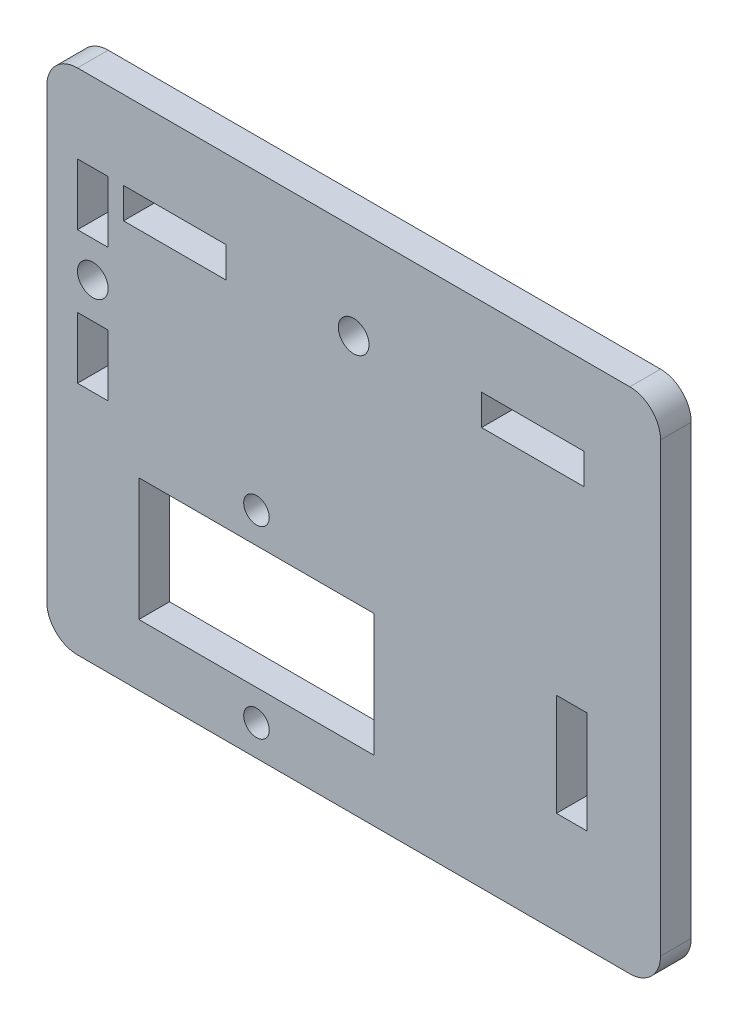
from build123d import *

# Parameters (mm, degrees)
SKETCH_1_R      = 1.25
SKETCH_1_R_2    = 1.500000003
SKETCH_1_R_3    = 1.500000002
EXTRUDE_1_DEPTH = 3


with BuildPart() as part:
    # 草圖1 → 填料-伸長1 (new body)
    with BuildSketch(Plane.XY):
        with BuildLine():
            Line((88.500524103, 145.700017948), (35.000524103, 145.700292307))
            ThreePointArc((35.000524103, 145.700292307), (32.879119595, 144.821703189), (32.000508719, 142.700307692))
            Line((32.000508719, 142.700307692), (32.000300001, 99.000307693))
            ThreePointArc((32.000300001, 99.000307693), (32.878839121, 96.878853187), (35.000284616, 96.000292308))
            Line((35.000284616, 96.000292308), (89.000284615, 96.000015385))
            ThreePointArc((89.000284615, 96.000015385), (91.121639122, 96.878654505), (92.0003, 99))
            Line((92.0003, 99), (92.000408718, 142.7))
            ThreePointArc((92.000408718, 142.7), (91.121779951, 144.82129415), (89.000524103, 145.700015384))
            Line((89.000524103, 145.700015384), (88.500524103, 145.700017948))
        make_face()
        with Locations((52.50039487, 117.000202566)):
            Circle(SKETCH_1_R, mode=Mode.SUBTRACT)
        with Locations((52.500297434, 99.000202566)):
            Circle(SKETCH_1_R, mode=Mode.SUBTRACT)
        with Locations((36.500451283, 128.500284615)):
            Circle(SKETCH_1_R_2, mode=Mode.SUBTRACT)
        with Locations((62.000492306, 136.500153847)):
            Circle(SKETCH_1_R_3, mode=Mode.SUBTRACT)
        Polygon((84.824140487, 116.000036801), (84.824089205, 106.000036801), (81.824089205, 106.000052186), (81.824140487, 116.000052185), align=None, mode=Mode.SUBTRACT)
        Polygon((64.000315385, 102.00014359), (64.000376923, 114.00014359), (41.000376924, 114.000261539), (41.000315385, 102.000261539), align=None, mode=Mode.SUBTRACT)
        Polygon((38.000402565, 119.000276923), (35.000402565, 119.000292308), (35.000433334, 125.000292308), (38.000433334, 125.000276923), align=None, mode=Mode.SUBTRACT)
        Polygon((38.000469231, 132.000276923), (35.000469231, 132.000292308), (35.000500001, 138.000292308), (38.000500001, 138.000276923), align=None, mode=Mode.SUBTRACT)
        Polygon((39.500500001, 138.000269231), (39.500484616, 135.000269231), (49.500484616, 135.000217948), (49.500500001, 138.000217948), align=None, mode=Mode.SUBTRACT)
        Polygon((74.500484616, 135.000089743), (84.500484615, 135.000038461), (84.5005, 138.000038461), (74.5005, 138.000089743), align=None, mode=Mode.SUBTRACT)
    extrude(amount=EXTRUDE_1_DEPTH)


solid = part.part
